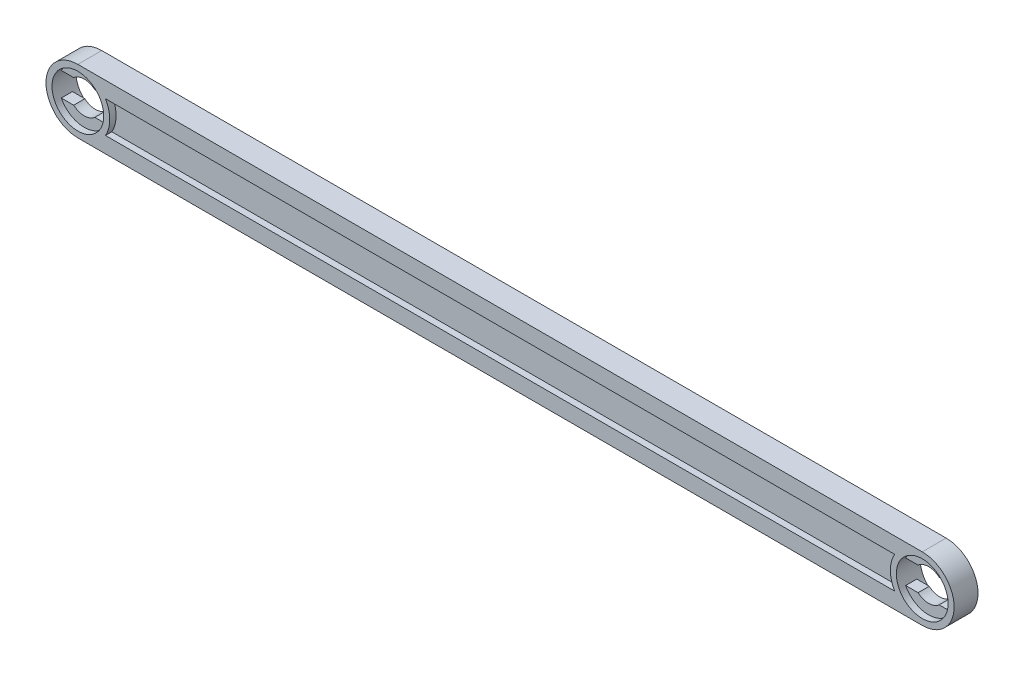
from build123d import *

# Parameters (mm, degrees)
EXTRUDE_1_DEPTH        = 3
CUT_EXTRUDE_1_REACH    = 112.114
SKETCH_3_R             = 3.25
CUT_EXTRUDE_2_DEPTH    = 0.8
CUT_EXTRUDE_START      = -2.2
SKETCH_3_2_R           = 3.25
CUT_EXTRUDE_3_DEPTH    = 0.8
PATTERN_LINEAR_1_COUNT = 2
PATTERN_LINEAR_1_PITCH = 106
CUT_EXTRUDE_4_DEPTH    = 0.8
SKETCH_5_W             = 98
SKETCH_5_H             = 4
CUT_EXTRUDE_5_DEPTH    = 0.8


with BuildPart() as part:
    # 草图1 → 凸台-拉伸1 (new body)
    with BuildSketch(Plane.XY):
        with BuildLine():
            Line((0, 4), (106, 4))
            ThreePointArc((106, 4), (110, 0), (106, -4))
            Line((106, -4), (0, -4))
            ThreePointArc((0, -4), (-4, 0), (0, 4))
        make_face()
    extrude(amount=-EXTRUDE_1_DEPTH)

    # 草图2 → 切除-拉伸1 (cut, up to next)
    with BuildSketch(Plane.XY, mode=Mode.PRIVATE) as cut_extrude_1_sk1:
        with BuildLine():
            Line((1.322875656, -1.5), (2.883140649, -1.5))
            ThreePointArc((2.883140649, -1.5), (3.25, 0), (2.883140649, 1.5))
            Line((2.883140649, 1.5), (1.322875656, 1.5))
            ThreePointArc((1.322875656, 1.5), (0, 2), (-1.322875656, 1.5))
            Line((-1.322875656, 1.5), (-2.883140649, 1.5))
            ThreePointArc((-2.883140649, 1.5), (-3.25, 0), (-2.883140649, -1.5))
            Line((-2.883140649, -1.5), (-1.322875656, -1.5))
            ThreePointArc((-1.322875656, -1.5), (0, -2), (1.322875656, -1.5))
        make_face()
    cut_extrude_1_tool1 = extrude(cut_extrude_1_sk1.sketch, amount=-CUT_EXTRUDE_1_REACH, mode=Mode.PRIVATE) & part.part
    cut_extrude_1 = cut_extrude_1_tool1.solids().sort_by_distance((0, 0, 0))[0]
    add(cut_extrude_1, mode=Mode.SUBTRACT)

    # 草图3 → 切除-拉伸2 (cut)
    with BuildSketch(Plane.XY):
        Circle(SKETCH_3_R)
    cut_extrude_2 = extrude(amount=-CUT_EXTRUDE_2_DEPTH, mode=Mode.SUBTRACT)

    # 草图3<2> → 切除-拉伸3 (cut)
    with BuildSketch(Plane.XY.offset(CUT_EXTRUDE_START)):
        Circle(SKETCH_3_2_R)
    cut_extrude_3 = extrude(amount=-CUT_EXTRUDE_3_DEPTH, mode=Mode.SUBTRACT)

    # 阵列(线性)1: 切除-拉伸1, 切除-拉伸2, 切除-拉伸3 ×2
    with Locations(*[(i * PATTERN_LINEAR_1_PITCH, 0, 0) for i in range(1, PATTERN_LINEAR_1_COUNT)]):
        add(cut_extrude_1, mode=Mode.SUBTRACT)
        add(cut_extrude_2, mode=Mode.SUBTRACT)
        add(cut_extrude_3, mode=Mode.SUBTRACT)

    # 草图4 → 切除-拉伸4 (cut)
    with BuildSketch(Plane.XY):
        with BuildLine():
            Line((3.464101615, 2), (102.535898385, 2))
            ThreePointArc((102.535898385, 2), (102, 0), (102.535898385, -2))
            Line((102.535898385, -2), (3.464101615, -2))
            ThreePointArc((3.464101615, -2), (4, 0), (3.464101615, 2))
        make_face()
    extrude(amount=-CUT_EXTRUDE_4_DEPTH, mode=Mode.SUBTRACT)

    # 草图5 → 切除-拉伸5 (cut)
    with BuildSketch(Plane(origin=(0, 0, -3), x_dir=(-1, 0, 0), z_dir=(0, 0, -1))):
        with Locations((-53, 0)):
            Rectangle(SKETCH_5_W, SKETCH_5_H)
    extrude(amount=-CUT_EXTRUDE_5_DEPTH, mode=Mode.SUBTRACT)


solid = part.part
